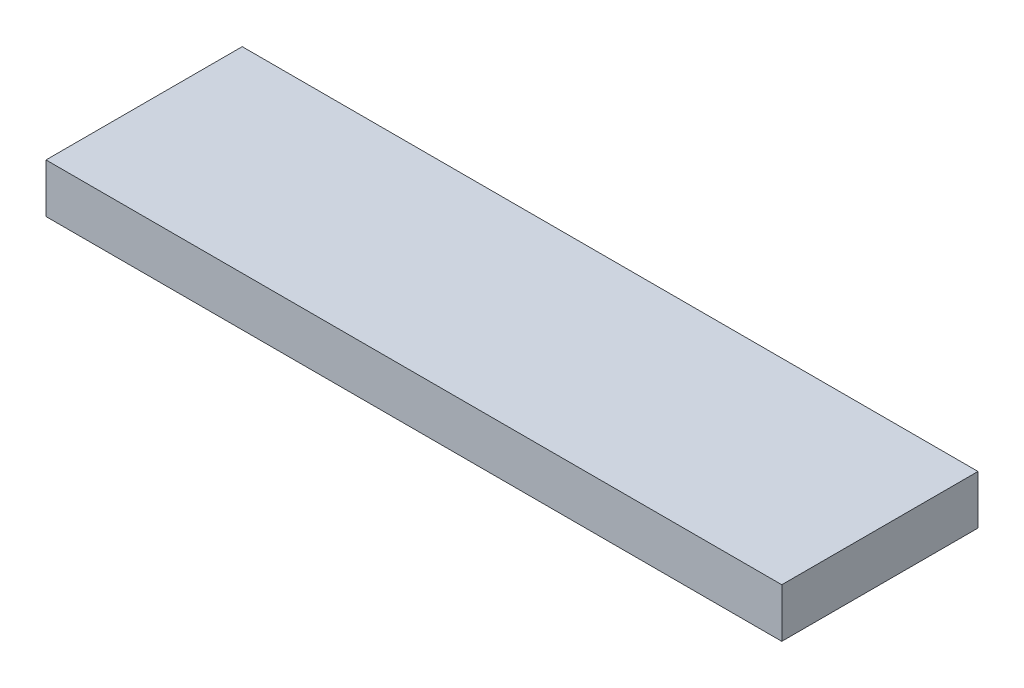
from build123d import *

# Parameters (mm, degrees)
SKETCH1_W           = 15
SKETCH1_H           = 4
BOSS_EXTRUDE1_DEPTH = 1


with BuildPart() as part:
    # Sketch1 → Boss-Extrude1 (new body)
    with BuildSketch(Plane(origin=(0, 0, 0), x_dir=(1, 0, 0), z_dir=(0, 1, 0))):
        with Locations((7.5, -2)):
            Rectangle(SKETCH1_W, SKETCH1_H)
    extrude(amount=BOSS_EXTRUDE1_DEPTH)


solid = part.part
